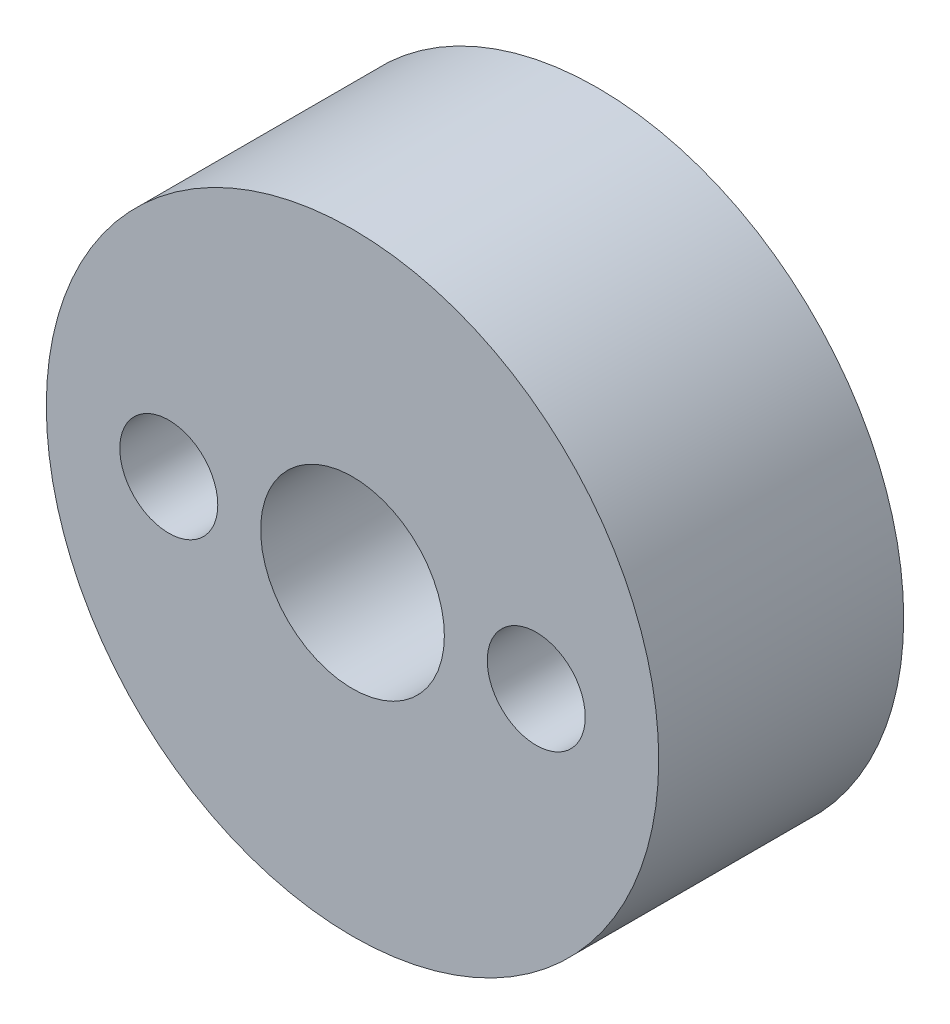
from build123d import *

# Parameters (mm, degrees)
SKETCH_1_R      = 10
SKETCH_1_R_2    = 3
SKETCH_1_R_3    = 1.6
EXTRUDE_1_DEPTH = 8


with BuildPart() as part:
    # ｽｹｯﾁ1 → ﾎﾞｽ - 押し出し1 (new body)
    with BuildSketch(Plane.XY):
        Circle(SKETCH_1_R)
        Circle(SKETCH_1_R_2, mode=Mode.SUBTRACT)
        with Locations((-6, 0)):
            Circle(SKETCH_1_R_3, mode=Mode.SUBTRACT)
        with Locations((6, 0)):
            Circle(SKETCH_1_R_3, mode=Mode.SUBTRACT)
    extrude(amount=EXTRUDE_1_DEPTH)


solid = part.part
